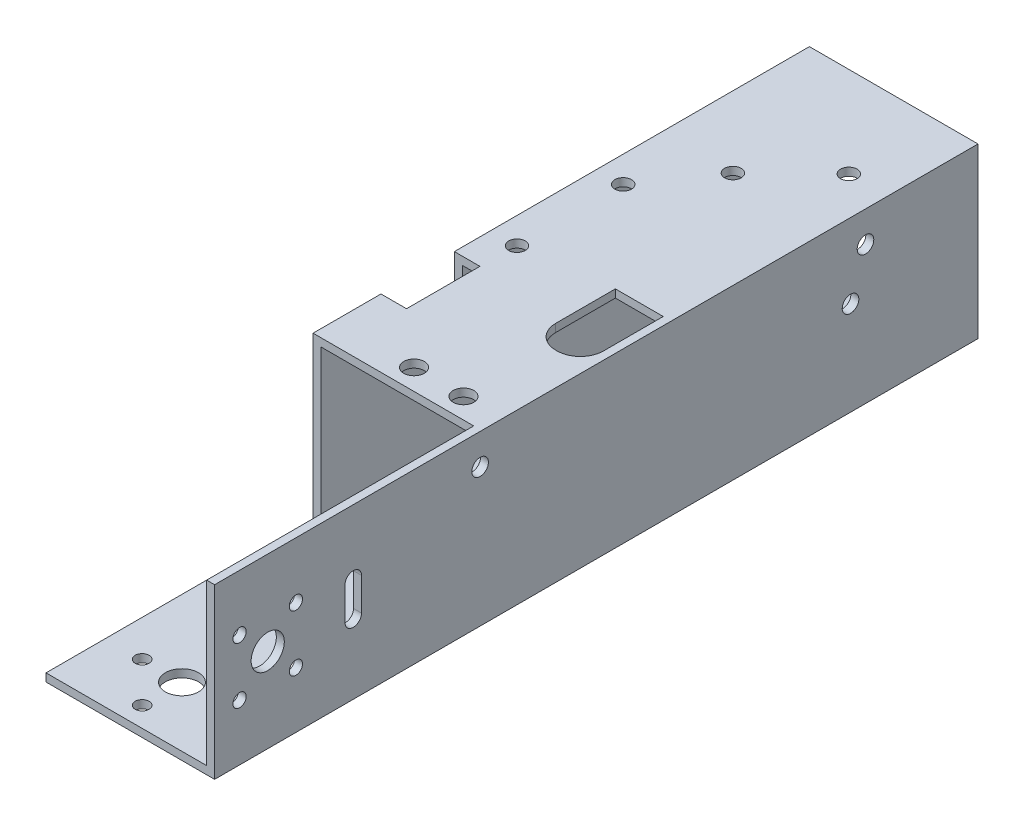
from build123d import *

# Parameters (mm, degrees)
SKETCH1_W           = 25.4
SKETCH1_H           = 25.4
SKETCH1_W_2         = 23
SKETCH1_H_2         = 23
BOSS_EXTRUDE1_DEPTH = 115
CUT_EXTRUDE1_START  = -24.2
SKETCH2_W           = 40.231781255
SKETCH2_H           = 27.281754711
CUT_EXTRUDE1_DEPTH  = 24.2
SKETCH5_R           = 1
SKETCH5_R_2         = 2.5
SKETCH5_R_3         = 1.25
CUT_EXTRUDE4_DEPTH  = 10
CUT_EXTRUDE2_REACH  = 142.365
SKETCH3_R           = 1.25
SKETCH3_R_2         = 1.05
SKETCH3_R_3         = 2.5
SKETCH6_R           = 1.6
SKETCH6_R_2         = 1.25
CUT_EXTRUDE5_DEPTH  = 8
SKETCH3_3_R         = 1.25
CUT_EXTRUDE9_DEPTH  = 141.364864582
SKETCH10_R          = 1.55
SKETCH10_R_2        = 1.25
SKETCH10_W          = 7.208576747
SKETCH10_H          = 12.490715562
SKETCH10_W_2        = 3.851256807
SKETCH10_H_2        = 11.057621271
CUT_EXTRUDE10_DEPTH = 5
FILLET1_R           = 3.5
SKETCH11_R          = 1.25
CUT_EXTRUDE11_DEPTH = 8


with BuildPart() as part:
    # Sketch1 → Boss-Extrude1 (new body)
    with BuildSketch(Plane.XY):
        with Locations((63.668417616, 21.669583611)):
            Rectangle(SKETCH1_W, SKETCH1_H)
        with Locations((63.668417616, 21.669583611)):
            Rectangle(SKETCH1_W_2, SKETCH1_H_2, mode=Mode.SUBTRACT)
    extrude(amount=BOSS_EXTRUDE1_DEPTH)

    # Sketch2 → Cut-Extrude1 (cut)
    with BuildSketch(Plane.ZY.offset(-50.968417616).offset(CUT_EXTRUDE1_START)):
        with Locations((94.884109373, 23.810460967)):
            Rectangle(SKETCH2_W, SKETCH2_H)
    extrude(amount=CUT_EXTRUDE1_DEPTH, mode=Mode.SUBTRACT)

    # Sketch5 → Cut-Extrude4 (cut)
    with BuildSketch(Plane(origin=(76.368417616, 0, 0), x_dir=(0, 0, -1), z_dir=(1, 0, 0))):
        with Locations((-102.757359313, 25.912224298)):
            Circle(SKETCH5_R)
        with Locations((-111.242640687, 25.912224298)):
            Circle(SKETCH5_R)
        with Locations((-111.242640687, 17.426942923)):
            Circle(SKETCH5_R)
        with Locations((-102.757359313, 17.426942923)):
            Circle(SKETCH5_R)
        with Locations((-107, 21.669583611)):
            Circle(SKETCH5_R_2)
        with Locations((-16.95, 29.737819564)):
            Circle(SKETCH5_R_3)
        with Locations((-75, 29.737819564)):
            Circle(SKETCH5_R_3)
        with Locations((-19.204163056, 23.117794927)):
            Circle(SKETCH5_R_3)
        with BuildLine():
            Line((-95.356264863, 19.604734734), (-95.356264863, 24.520728377))
            ThreePointArc((-95.356264863, 24.520728377), (-94.114846786, 25.762146454), (-92.87342871, 24.520728377))
            Line((-92.87342871, 24.520728377), (-92.87342871, 19.604734734))
            ThreePointArc((-92.87342871, 19.604734734), (-94.114846786, 18.363316658), (-95.356264863, 19.604734734))
        make_face()
    extrude(amount=-CUT_EXTRUDE4_DEPTH, mode=Mode.SUBTRACT)

    # Sketch3 → Cut-Extrude2 (cut, up to next)
    with BuildSketch(Plane.XZ.offset(-8.969583611), mode=Mode.PRIVATE) as cut_extrude2_sk1:
        with Locations(Location((54.918417616, 32, 0), (0, 0, 270))):
            Circle(SKETCH3_R)
    cut_extrude2_tool1 = extrude(cut_extrude2_sk1.sketch, amount=-CUT_EXTRUDE2_REACH, mode=Mode.PRIVATE) & part.part
    # Sketch3 → Cut-Extrude2 (cut, up to next)
    with BuildSketch(Plane.XZ.offset(-8.969583611), mode=Mode.PRIVATE) as cut_extrude2_sk2:
        with Locations(Location((54.918417616, 48, 0), (0, 0, 270))):
            Circle(SKETCH3_R)
    cut_extrude2_tool2 = extrude(cut_extrude2_sk2.sketch, amount=-CUT_EXTRUDE2_REACH, mode=Mode.PRIVATE) & part.part
    # Sketch3 → Cut-Extrude2 (cut, up to next)
    with BuildSketch(Plane.XZ.offset(-8.969583611), mode=Mode.PRIVATE) as cut_extrude2_sk3:
        with Locations(Location((56.439865007, 105.989791795, 0), (0, 0, 270))):
            Circle(SKETCH3_R_2)
    cut_extrude2_tool3 = extrude(cut_extrude2_sk3.sketch, amount=-CUT_EXTRUDE2_REACH, mode=Mode.PRIVATE) & part.part
    # Sketch3 → Cut-Extrude2 (cut, up to next)
    with BuildSketch(Plane.XZ.offset(-8.969583611), mode=Mode.PRIVATE) as cut_extrude2_sk4:
        with Locations(Location((62.439865007, 111.989791795, 0), (0, 0, 270))):
            Circle(SKETCH3_R_2)
    cut_extrude2_tool4 = extrude(cut_extrude2_sk4.sketch, amount=-CUT_EXTRUDE2_REACH, mode=Mode.PRIVATE) & part.part
    # Sketch3 → Cut-Extrude2 (cut, up to next)
    with BuildSketch(Plane.XZ.offset(-8.969583611), mode=Mode.PRIVATE) as cut_extrude2_sk5:
        with Locations(Location((68.439865007, 105.989791795, 0), (0, 0, 270))):
            Circle(SKETCH3_R_2)
    cut_extrude2_tool5 = extrude(cut_extrude2_sk5.sketch, amount=-CUT_EXTRUDE2_REACH, mode=Mode.PRIVATE) & part.part
    # Sketch3 → Cut-Extrude2 (cut, up to next)
    with BuildSketch(Plane.XZ.offset(-8.969583611), mode=Mode.PRIVATE) as cut_extrude2_sk6:
        with Locations(Location((62.439865007, 99.989791795, 0), (0, 0, 270))):
            Circle(SKETCH3_R_2)
    cut_extrude2_tool6 = extrude(cut_extrude2_sk6.sketch, amount=-CUT_EXTRUDE2_REACH, mode=Mode.PRIVATE) & part.part
    # Sketch3 → Cut-Extrude2 (cut, up to next)
    with BuildSketch(Plane.XZ.offset(-8.969583611), mode=Mode.PRIVATE) as cut_extrude2_sk7:
        with Locations(Location((62.439865007, 105.989791795, 0), (0, 0, 270))):
            Circle(SKETCH3_R_3)
    cut_extrude2_tool7 = extrude(cut_extrude2_sk7.sketch, amount=-CUT_EXTRUDE2_REACH, mode=Mode.PRIVATE) & part.part
    # Sketch3 → Cut-Extrude2 (cut, up to next)
    with BuildSketch(Plane.XZ.offset(-8.969583611), mode=Mode.PRIVATE) as cut_extrude2_sk8:
        with BuildLine():
            Line((65.785875381, 94.116283864), (70.188234194, 98.978147268))
            ThreePointArc((70.188234194, 98.978147268), (72.324899993, 99.084125699), (72.430878425, 96.947459901))
            Line((72.430878425, 96.947459901), (68.028519611, 92.085596497))
            ThreePointArc((68.028519611, 92.085596497), (65.891853813, 91.979618066), (65.785875381, 94.116283864))
        make_face()
    cut_extrude2_tool8 = extrude(cut_extrude2_sk8.sketch, amount=-CUT_EXTRUDE2_REACH, mode=Mode.PRIVATE) & part.part
    add(cut_extrude2_tool1.solids().sort_by_distance((54.918418, 8.969584, 32))[0], mode=Mode.SUBTRACT)
    add(cut_extrude2_tool2.solids().sort_by_distance((54.918418, 8.969584, 48))[0], mode=Mode.SUBTRACT)
    add(cut_extrude2_tool3.solids().sort_by_distance((56.439865, 8.969584, 105.989792))[0], mode=Mode.SUBTRACT)
    add(cut_extrude2_tool4.solids().sort_by_distance((62.439865, 8.969584, 111.989792))[0], mode=Mode.SUBTRACT)
    add(cut_extrude2_tool5.solids().sort_by_distance((68.439865, 8.969584, 105.989792))[0], mode=Mode.SUBTRACT)
    add(cut_extrude2_tool6.solids().sort_by_distance((62.439865, 8.969584, 99.989792))[0], mode=Mode.SUBTRACT)
    add(cut_extrude2_tool7.solids().sort_by_distance((62.439865, 8.969584, 105.989792))[0], mode=Mode.SUBTRACT)
    add(cut_extrude2_tool8.solids().sort_by_distance((69.108377, 8.969584, 95.531872))[0], mode=Mode.SUBTRACT)

    # Sketch6 → Cut-Extrude5 (cut)
    with BuildSketch(Plane(origin=(0, 8.969583611, 0), x_dir=(-1, 0, 0), z_dir=(0, -1, 0))):
        with Locations(Location((-70.405494882, -82.5, 0), (0, 0, 90))):
            Circle(SKETCH6_R)
        with Locations(Location((-56.074218123, -82.5, 0), (0, 0, 90))):
            Circle(SKETCH6_R)
        with Locations(Location((-61.706346911, -18.454172536, 0), (0, 0, 90))):
            Circle(SKETCH6_R_2)
    extrude(amount=-CUT_EXTRUDE5_DEPTH, mode=Mode.SUBTRACT)

    # Sketch3<3> → Cut-Extrude9 (cut, through all)
    with BuildSketch(Plane.XZ.offset(-8.969583611)):
        with Locations(Location((54.918417616, 32, 0), (0, 0, 270))):
            Circle(SKETCH3_3_R)
        with Locations(Location((54.918417616, 48, 0), (0, 0, 270))):
            Circle(SKETCH3_3_R)
    extrude(amount=-CUT_EXTRUDE9_DEPTH, mode=Mode.SUBTRACT)

    # Sketch10 → Cut-Extrude10 (cut)
    with BuildSketch(Plane(origin=(0, 34.369583611, 0), x_dir=(1, 0, 0), z_dir=(0, 1, 0))):
        with Locations(Location((63.038171916, -71.624774794, 0), (0, 0, 270))):
            Circle(SKETCH10_R)
        with Locations(Location((70.543887237, -71.685759742, 0), (0, 0, 270))):
            Circle(SKETCH10_R)
        with Locations(Location((61.706346911, -22.262070014, 0), (0, 0, 270))):
            Circle(SKETCH10_R_2)
        with Locations(Location((70.543887237, -13.635759742, 0), (0, 0, 270))):
            Circle(SKETCH10_R_2)
        with Locations((71.564129243, -52.463622479)):
            Rectangle(SKETCH10_W, SKETCH10_H)
        with Locations((52.89404602, -59.010132705)):
            Rectangle(SKETCH10_W_2, SKETCH10_H_2)
    extrude(amount=-CUT_EXTRUDE10_DEPTH, mode=Mode.SUBTRACT)

    # Fillet1
    fillet1_edges = [part.edges().sort_by_distance(p)[0] for p in [
        (67.959840869, 33.769583611, 58.70898026),
        (75.168417616, 33.769583611, 58.70898026),
    ]]
    fillet(fillet1_edges, radius=FILLET1_R)

    # Sketch11 → Cut-Extrude11 (cut)
    with BuildSketch(Plane.ZY.offset(-50.968417616)):
        with Locations(Location((22.262070014, 23.117794927, 0), (0, 0, 270))):
            Circle(SKETCH11_R)
    extrude(amount=-CUT_EXTRUDE11_DEPTH, mode=Mode.SUBTRACT)


solid = part.part
